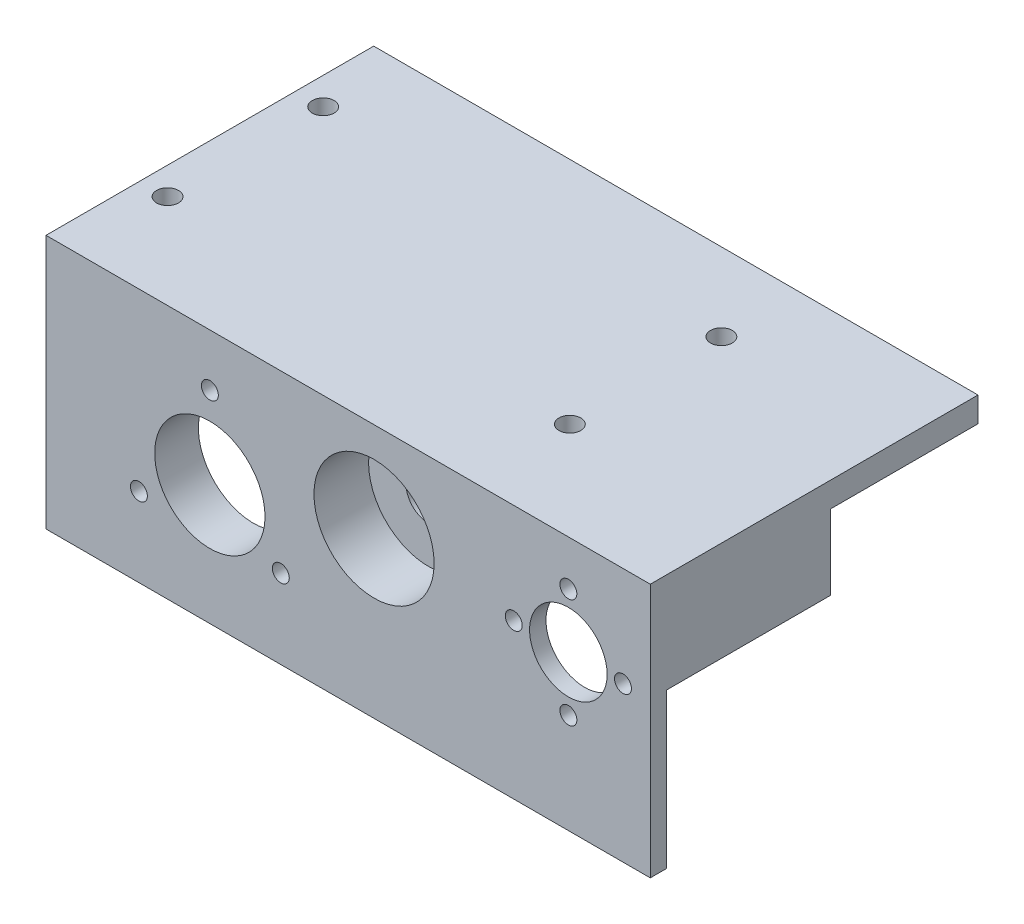
from build123d import *
from build123d.topology import SkipClean

# Parameters (mm, degrees)
SKETCH1_W            = 110.639208532
SKETCH1_H            = 42
SKETCH1_R            = 7.1
SKETCH1_R_2          = 1.55
SKETCH1_R_3          = 10.1
SKETCH1_R_4          = 4.1
BOSS_EXTRUDE1_DEPTH  = 3
SKETCH2_W            = 110.639208532
SKETCH2_H            = 4.57
BOSS_EXTRUDE2_DEPTH  = 60
BOSS_EXTRUDE3_DEPTH  = 30
CUT_EXTRUDE1_DEPTH   = 60
BOSS_EXTRUDE4_DEPTH  = 7
BOSS_EXTRUDE5_START  = 7
BOSS_EXTRUDE5_DEPTH  = 16
BOSS_EXTRUDE6_START  = 23
BOSS_EXTRUDE6_DEPTH  = 7
SKETCH5_R            = 19.6
CUT_EXTRUDE2_DEPTH   = 133.886415275
SKETCH6_W            = 11.579942488
SKETCH6_H            = 30
CUT_EXTRUDE3_DEPTH   = 7
SKETCH7_R            = 2
CUT_EXTRUDE4_DEPTH   = 129.040267732
SKETCH8_R            = 2
CUT_EXTRUDE5_DEPTH   = 7
SKETCH1_6_R          = 1.55
BOSS_EXTRUDE8_DEPTH  = 5
SKETCH9_W            = 55.909266044
SKETCH9_H            = 42
SKETCH9_R            = 19.3
BOSS_EXTRUDE11_DEPTH = 5
SKETCH10_R           = 11
CUT_EXTRUDE6_DEPTH   = 10


with BuildPart() as part:
    # Sketch1 → Boss-Extrude1 (new body)
    with BuildSketch(Plane.XY):
        with Locations((55.319604266, 21)):
            Rectangle(SKETCH1_W, SKETCH1_H)
        with Locations((95.639208532, 28.3)):
            Circle(SKETCH1_R, mode=Mode.SUBTRACT)
        with Locations((95.639208532, 38.3)):
            Circle(SKETCH1_R_2, mode=Mode.SUBTRACT)
        with Locations((30, 22)):
            Circle(SKETCH1_R_3, mode=Mode.SUBTRACT)
        with Locations((60.059266044, 30.07117717)):
            Circle(SKETCH1_R_4, mode=Mode.SUBTRACT)
        with Locations((30, 37)):
            Circle(SKETCH1_R_2, mode=Mode.SUBTRACT)
        with Locations((105.639208532, 28.3)):
            Circle(SKETCH1_R_2, mode=Mode.SUBTRACT)
        with Locations((95.639208532, 18.3)):
            Circle(SKETCH1_R_2, mode=Mode.SUBTRACT)
        with Locations((85.639208532, 28.3)):
            Circle(SKETCH1_R_2, mode=Mode.SUBTRACT)
        with Locations((42.990381057, 14.5)):
            Circle(SKETCH1_R_2, mode=Mode.SUBTRACT)
        with Locations((17.009618943, 14.5)):
            Circle(SKETCH1_R_2, mode=Mode.SUBTRACT)
    extrude(amount=BOSS_EXTRUDE1_DEPTH)

    # Sketch2 → Boss-Extrude2 (add)
    with BuildSketch(Plane(origin=(0, 0, 3), x_dir=(-1, 0, 0), z_dir=(0, 0, -1))):
        with Locations((-55.319604266, 44.285)):
            Rectangle(SKETCH2_W, SKETCH2_H)
    extrude(amount=BOSS_EXTRUDE2_DEPTH)

    # Sketch1<3> → Boss-Extrude3 (add)
    with BuildSketch(Plane.XY):
        with BuildLine():
            Line((95.639208532, 42), (80.639208532, 42))
            Line((80.639208532, 42), (80.639208532, 28.3))
            Line((80.639208532, 28.3), (82.639208532, 28.3))
            ThreePointArc((82.639208532, 28.3), (86.446820376, 37.492388155), (95.639208532, 41.3))
            Line((95.639208532, 41.3), (95.639208532, 42))
        make_face()
        with BuildLine():
            Line((110.639208532, 42), (95.639208532, 42))
            Line((95.639208532, 42), (95.639208532, 41.3))
            ThreePointArc((95.639208532, 41.3), (104.831596687, 37.492388155), (108.639208532, 28.3))
            Line((108.639208532, 28.3), (110.639208532, 28.3))
            Line((110.639208532, 28.3), (110.639208532, 42))
        make_face()
    extrude(amount=-BOSS_EXTRUDE3_DEPTH)

    # Sketch3 → Cut-Extrude1 (cut)
    with BuildSketch(Plane(origin=(0, 0, 0), x_dir=(-1, 0, 0), z_dir=(0, 0, -1))):
        with BuildLine():
            ThreePointArc((-55.909266044, 30.07117717), (-60.059266044, 25.92117717), (-64.209266044, 30.07117717))
            Line((-64.209266044, 30.07117717), (-71.059266044, 30.07117717))
            ThreePointArc((-71.059266044, 30.07117717), (-60.059266044, 19.07117717), (-49.059266044, 30.07117717))
            Line((-49.059266044, 30.07117717), (-55.909266044, 30.07117717))
        make_face()
        with BuildLine():
            Line((-71.059266044, 30.07117717), (-64.209266044, 30.07117717))
            ThreePointArc((-64.209266044, 30.07117717), (-60.059266044, 34.22117717), (-55.909266044, 30.07117717))
            Line((-55.909266044, 30.07117717), (-49.059266044, 30.07117717))
            ThreePointArc((-49.059266044, 30.07117717), (-60.059266044, 41.07117717), (-71.059266044, 30.07117717))
        make_face()
    extrude(amount=-CUT_EXTRUDE1_DEPTH, mode=Mode.SUBTRACT)


with BuildPart() as cut_extrude1_kept_piece:
    # of the separate pieces the step leaves, the one the design keeps (cut_extrude1_pieces_kept)
    add(part.part.solids().sort_by_distance((110.639208532, 0, 0))[0])

    # Sketch3<3> → Boss-Extrude4 (add)
    with BuildSketch(Plane(origin=(0, 0, 0), x_dir=(-1, 0, 0), z_dir=(0, 0, -1))):
        with BuildLine():
            ThreePointArc((-49.059266044, 30.07117717), (-60.059266044, 19.07117717), (-71.059266044, 30.07117717))
            Line((-71.059266044, 30.07117717), (-73.059266044, 30.07117717))
            ThreePointArc((-73.059266044, 30.07117717), (-60.059266044, 17.07117717), (-47.059266044, 30.07117717))
            Line((-47.059266044, 30.07117717), (-49.059266044, 30.07117717))
        make_face()
        with BuildLine():
            Line((-73.059266044, 30.07117717), (-71.059266044, 30.07117717))
            ThreePointArc((-71.059266044, 30.07117717), (-60.059266044, 41.07117717), (-49.059266044, 30.07117717))
            Line((-49.059266044, 30.07117717), (-47.059266044, 30.07117717))
            ThreePointArc((-47.059266044, 30.07117717), (-49.192397519, 37.206383436), (-54.891753501, 42))
            Line((-54.891753501, 42), (-65.226778587, 42))
            ThreePointArc((-65.226778587, 42), (-70.926134568, 37.206383436), (-73.059266044, 30.07117717))
        make_face()
        with BuildLine():
            ThreePointArc((-54.891753501, 42), (-49.192397519, 37.206383436), (-47.059266044, 30.07117717))
            Line((-47.059266044, 30.07117717), (-47.059266044, 42))
            Line((-47.059266044, 42), (-54.891753501, 42))
        make_face()
        with BuildLine():
            Line((-80.639208532, 30.07117717), (-73.059266044, 30.07117717))
            ThreePointArc((-73.059266044, 30.07117717), (-70.926134568, 37.206383436), (-65.226778587, 42))
            Line((-65.226778587, 42), (-80.639208532, 42))
            Line((-80.639208532, 42), (-80.639208532, 30.07117717))
        make_face()
    extrude(amount=BOSS_EXTRUDE4_DEPTH)

    # Sketch3<4> → Boss-Extrude5 (add)
    with BuildSketch(Plane(origin=(0, 0, 0), x_dir=(-1, 0, 0), z_dir=(0, 0, -1)).offset(BOSS_EXTRUDE5_START)):
        with BuildLine():
            ThreePointArc((-54.891753501, 42), (-49.192397519, 37.206383436), (-47.059266044, 30.07117717))
            Line((-47.059266044, 30.07117717), (-47.059266044, 42))
            Line((-47.059266044, 42), (-54.891753501, 42))
        make_face()
        with BuildLine():
            ThreePointArc((-55.909266044, 30.07117717), (-60.059266044, 25.92117717), (-64.209266044, 30.07117717))
            Line((-64.209266044, 30.07117717), (-71.059266044, 30.07117717))
            ThreePointArc((-71.059266044, 30.07117717), (-60.059266044, 19.07117717), (-49.059266044, 30.07117717))
            Line((-49.059266044, 30.07117717), (-55.909266044, 30.07117717))
        make_face()
        with BuildLine():
            Line((-71.059266044, 30.07117717), (-64.209266044, 30.07117717))
            ThreePointArc((-64.209266044, 30.07117717), (-60.059266044, 34.22117717), (-55.909266044, 30.07117717))
            Line((-55.909266044, 30.07117717), (-49.059266044, 30.07117717))
            ThreePointArc((-49.059266044, 30.07117717), (-60.059266044, 41.07117717), (-71.059266044, 30.07117717))
        make_face()
        with BuildLine():
            Line((-80.639208532, 30.07117717), (-73.059266044, 30.07117717))
            ThreePointArc((-73.059266044, 30.07117717), (-70.926134568, 37.206383436), (-65.226778587, 42))
            Line((-65.226778587, 42), (-80.639208532, 42))
            Line((-80.639208532, 42), (-80.639208532, 30.07117717))
        make_face()
        with BuildLine():
            Line((-73.059266044, 30.07117717), (-71.059266044, 30.07117717))
            ThreePointArc((-71.059266044, 30.07117717), (-60.059266044, 41.07117717), (-49.059266044, 30.07117717))
            Line((-49.059266044, 30.07117717), (-47.059266044, 30.07117717))
            ThreePointArc((-47.059266044, 30.07117717), (-49.192397519, 37.206383436), (-54.891753501, 42))
            Line((-54.891753501, 42), (-65.226778587, 42))
            ThreePointArc((-65.226778587, 42), (-70.926134568, 37.206383436), (-73.059266044, 30.07117717))
        make_face()
        with BuildLine():
            ThreePointArc((-49.059266044, 30.07117717), (-60.059266044, 19.07117717), (-71.059266044, 30.07117717))
            Line((-71.059266044, 30.07117717), (-73.059266044, 30.07117717))
            ThreePointArc((-73.059266044, 30.07117717), (-60.059266044, 17.07117717), (-47.059266044, 30.07117717))
            Line((-47.059266044, 30.07117717), (-49.059266044, 30.07117717))
        make_face()
    extrude(amount=BOSS_EXTRUDE5_DEPTH)

    # Sketch3<5> → Boss-Extrude6 (add)
    with BuildSketch(Plane(origin=(0, 0, 0), x_dir=(-1, 0, 0), z_dir=(0, 0, -1)).offset(BOSS_EXTRUDE6_START)):
        with BuildLine():
            Line((-73.059266044, 30.07117717), (-71.059266044, 30.07117717))
            ThreePointArc((-71.059266044, 30.07117717), (-60.059266044, 41.07117717), (-49.059266044, 30.07117717))
            Line((-49.059266044, 30.07117717), (-47.059266044, 30.07117717))
            ThreePointArc((-47.059266044, 30.07117717), (-49.192397519, 37.206383436), (-54.891753501, 42))
            Line((-54.891753501, 42), (-65.226778587, 42))
            ThreePointArc((-65.226778587, 42), (-70.926134568, 37.206383436), (-73.059266044, 30.07117717))
        make_face()
        with BuildLine():
            ThreePointArc((-54.891753501, 42), (-49.192397519, 37.206383436), (-47.059266044, 30.07117717))
            Line((-47.059266044, 30.07117717), (-47.059266044, 42))
            Line((-47.059266044, 42), (-54.891753501, 42))
        make_face()
        with BuildLine():
            Line((-80.639208532, 30.07117717), (-73.059266044, 30.07117717))
            ThreePointArc((-73.059266044, 30.07117717), (-70.926134568, 37.206383436), (-65.226778587, 42))
            Line((-65.226778587, 42), (-80.639208532, 42))
            Line((-80.639208532, 42), (-80.639208532, 30.07117717))
        make_face()
        with BuildLine():
            ThreePointArc((-49.059266044, 30.07117717), (-60.059266044, 19.07117717), (-71.059266044, 30.07117717))
            Line((-71.059266044, 30.07117717), (-73.059266044, 30.07117717))
            ThreePointArc((-73.059266044, 30.07117717), (-60.059266044, 17.07117717), (-47.059266044, 30.07117717))
            Line((-47.059266044, 30.07117717), (-49.059266044, 30.07117717))
        make_face()
    extrude(amount=BOSS_EXTRUDE6_DEPTH)

    # Sketch5 → Cut-Extrude2 (cut, through all)
    with BuildSketch(Plane(origin=(0, 0, 0), x_dir=(-1, 0, 0), z_dir=(0, 0, -1))):
        with Locations((-30, 22)):
            Circle(SKETCH5_R)
    extrude(amount=CUT_EXTRUDE2_DEPTH, mode=Mode.SUBTRACT)

    # Sketch6 → Cut-Extrude3 (cut)
    with BuildSketch(Plane.XZ.offset(-30.07117717)):
        with Locations((78.849237288, -15)):
            Rectangle(SKETCH6_W, SKETCH6_H)
    extrude(amount=CUT_EXTRUDE3_DEPTH, mode=Mode.SUBTRACT)

    # Sketch7 → Cut-Extrude4 (cut, through all)
    with BuildSketch(Plane.XZ.offset(-30.07117717)):
        with Locations(Location((77.90984812, -15, 0), (0, 0, 270))):
            Circle(SKETCH7_R)
    extrude(amount=-CUT_EXTRUDE4_DEPTH, mode=Mode.SUBTRACT)

    # Sketch8 → Cut-Extrude5 (cut)
    with BuildSketch(Plane.XZ.offset(-42)):
        with Locations(Location((5, -14.25, 0), (0, 0, 270))):
            Circle(SKETCH8_R)
        with Locations(Location((5, -42.75, 0), (0, 0, 270))):
            Circle(SKETCH8_R)
        with BuildLine():
            ThreePointArc((77.90984812, -40.75), (76.495634557, -41.335786438), (75.90984812, -42.75))
            Line((75.90984812, -42.75), (77.90984812, -42.75))
            Line((77.90984812, -42.75), (77.90984812, -40.75))
        make_face()
        with BuildLine():
            Line((77.90984812, -42.75), (75.90984812, -42.75))
            ThreePointArc((75.90984812, -42.75), (76.495634557, -44.164213562), (77.90984812, -44.75))
            Line((77.90984812, -44.75), (77.90984812, -42.75))
        make_face()
        with BuildLine():
            Line((77.90984812, -40.75), (77.90984812, -42.75))
            Line((77.90984812, -42.75), (79.90984812, -42.75))
            ThreePointArc((79.90984812, -42.75), (79.324061682, -41.335786438), (77.90984812, -40.75))
        make_face()
        with BuildLine():
            Line((79.90984812, -42.75), (77.90984812, -42.75))
            Line((77.90984812, -42.75), (77.90984812, -44.75))
            ThreePointArc((77.90984812, -44.75), (79.324061682, -44.164213562), (79.90984812, -42.75))
        make_face()
        with BuildLine():
            ThreePointArc((7, -42.75), (5, -40.75), (3, -42.75))
            Line((3, -42.75), (7, -42.75))
        make_face()
        with BuildLine():
            Line((7, -42.75), (3, -42.75))
            ThreePointArc((3, -42.75), (5, -44.75), (7, -42.75))
        make_face()
    extrude(amount=-CUT_EXTRUDE5_DEPTH, mode=Mode.SUBTRACT)

    # Sketch1<6> → Boss-Extrude8 (add)
    with BuildSketch(Plane.XY):
        with BuildLine():
            ThreePointArc((49.3, 22), (43.647160877, 35.647160877), (30, 41.3))
            ThreePointArc((30, 41.3), (16.352839123, 8.352839123), (49.3, 22))
        make_face()
        with Locations((17.009618943, 14.5)):
            Circle(SKETCH1_6_R, mode=Mode.SUBTRACT)
        with Locations((42.990381057, 14.5)):
            Circle(SKETCH1_6_R, mode=Mode.SUBTRACT)
        with BuildLine():
            ThreePointArc((40.1, 22), (22.85822151, 14.85822151), (30, 32.1))
            ThreePointArc((30, 32.1), (37.14177849, 29.14177849), (40.1, 22))
        make_face(mode=Mode.SUBTRACT)
        with BuildLine():
            ThreePointArc((30, 35.45), (28.45, 37), (30, 38.55))
            ThreePointArc((30, 38.55), (31.096015511, 38.096015511), (31.55, 37))
            ThreePointArc((31.55, 37), (31.096015511, 35.903984489), (30, 35.45))
        make_face(mode=Mode.SUBTRACT)
    extrude(amount=-BOSS_EXTRUDE8_DEPTH)

    # Sketch9 → Boss-Extrude11 (add)
    with BuildSketch(Plane(origin=(0, 0, -5), x_dir=(-1, 0, 0), z_dir=(0, 0, -1))):
        with Locations((-27.954633022, 21)):
            Rectangle(SKETCH9_W, SKETCH9_H)
        with Locations((-30, 22)):
            Circle(SKETCH9_R, mode=Mode.SUBTRACT)
    extrude(amount=-BOSS_EXTRUDE11_DEPTH)

    # Sketch10 → Cut-Extrude6 (cut)
    with SkipClean():  # the faces are left unmerged after this step: merging them gives an invalid solid
        with BuildSketch(Plane.XY.offset(3)):
            with Locations(Location((60.059266044, 30.07117717, 0), (0, 0, 180))):
                Circle(SKETCH10_R)
        extrude(amount=-CUT_EXTRUDE6_DEPTH, mode=Mode.SUBTRACT)


solid = cut_extrude1_kept_piece.part
